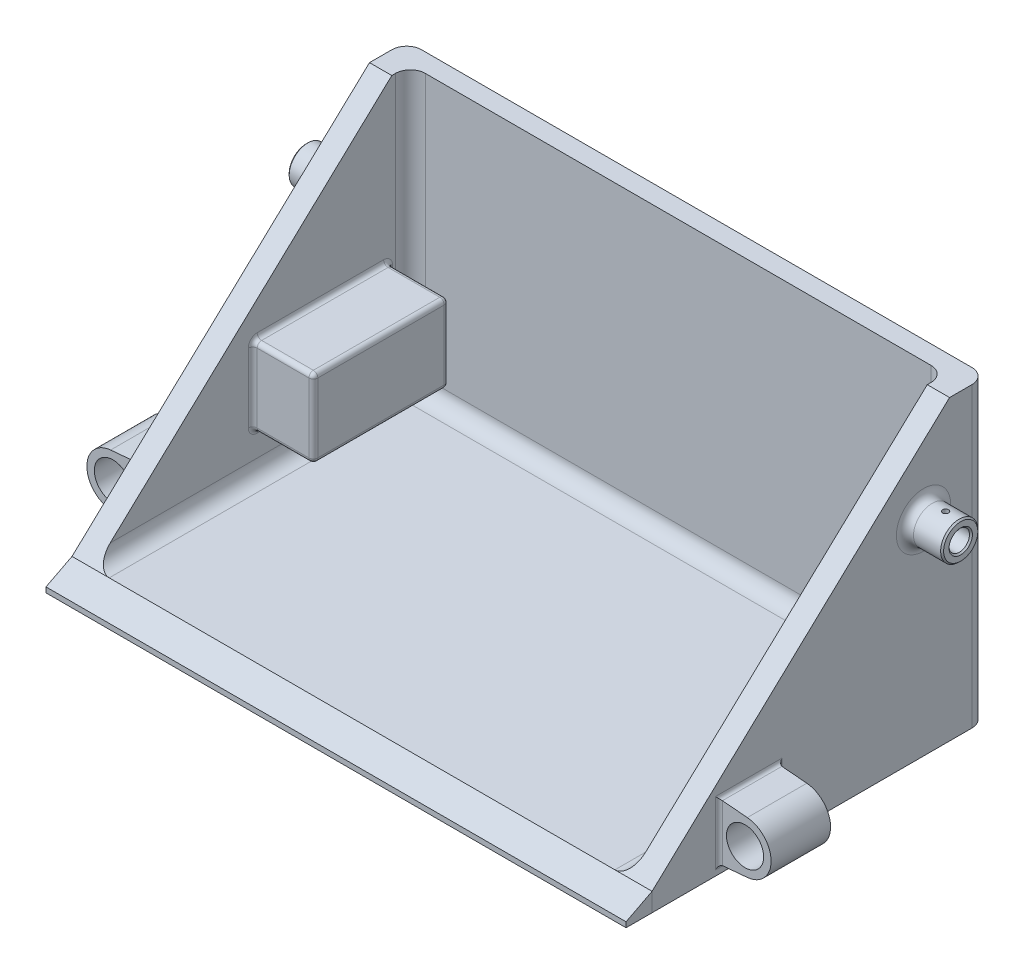
from build123d import *

# Parameters (mm, degrees)
SKETCH1_W               = 198.12
SKETCH1_H               = 114.3
BOSS_EXTRUDE1_DEPTH     = 3.175
BOSS_EXTRUDE2_DEPTH     = 7.62
SKETCH4_W               = 182.88
SKETCH4_H               = 6.35
BOSS_EXTRUDE3_DEPTH     = 95.25
BOSS_EXTRUDE4_DEPTH     = 198.12
FILLET2_R               = 5.08
FILLET3_R               = 5.08
SKETCH6_R               = 6.35
SKETCH6_R_2             = 3.4925
BOSS_EXTRUDE5_DEPTH     = 12.7
FILLET4_R               = 2.921
CHAMFER1_SIZE           = 0.508
SKETCH7_R               = 1.0033
CUT_EXTRUDE1_DEPTH      = 3.81
CIRPATTERN1_COUNT       = 2
CIRPATTERN1_ANGLE       = 90
MIRROR3_COPY_1_SKETCH_R = 1.0033
MIRROR3_COPY_1_DEPTH    = 3.81
SKETCH8_W               = 41.148
SKETCH8_H               = 21.59
CUT_EXTRUDE2_DEPTH      = 7.62
SKETCH9_W               = 46.228
SKETCH9_H               = 26.67
SKETCH9_W_2             = 41.148
SKETCH9_H_2             = 21.59
BOSS_EXTRUDE6_DEPTH     = 17.78
SKETCH10_W              = 46.228
SKETCH10_H              = 26.67
BOSS_EXTRUDE7_DEPTH     = 2.921
FILLET5_R               = 1.524
FILLET6_R               = 1.524
SKETCH11_W              = 7.62
SKETCH11_H              = 16.51
SKETCH11_R              = 1.524
BOSS_EXTRUDE8_DEPTH     = 3.81
FILLET7_R               = 1.27
SKETCH12_R              = 6.35
BOSS_EXTRUDE9_DEPTH     = 10.16
FILLET8_R               = 1.27


with BuildPart() as part:
    # Sketch1 → Boss-Extrude1 (new, symmetric)
    with BuildSketch(Plane(origin=(0, 0, 0), x_dir=(1, 0, 0), z_dir=(0, 1, 0))):
        Rectangle(SKETCH1_W, SKETCH1_H)
    extrude(amount=BOSS_EXTRUDE1_DEPTH, both=True)

    # Sketch3 → Boss-Extrude2 (add)
    with BuildSketch(Plane.ZY.offset(99.06)):
        Polygon((-57.15, 3.175), (-57.15, 98.425), (-44.45, 98.425), (57.15, 3.175), align=None)
    boss_extrude2 = extrude(amount=-BOSS_EXTRUDE2_DEPTH)

    # Mirror1: Boss-Extrude2 across plane
    add(boss_extrude2.mirror(Plane(origin=(0, 0, 0), x_dir=(0, 0, 1), z_dir=(1, 0, 0))))

    # Sketch4 → Boss-Extrude3 (add)
    with BuildSketch(Plane(origin=(0, 3.175, 0), x_dir=(1, 0, 0), z_dir=(0, 1, 0))):
        with Locations((0, 53.975)):
            Rectangle(SKETCH4_W, SKETCH4_H)
    extrude(amount=BOSS_EXTRUDE3_DEPTH)

    # Fillet2
    fillet2_edges = [part.edges().sort_by_distance(p)[0] for p in [
        (91.44, 3.175, 3.175),
        (-91.44, 3.175, 3.175),
        (-91.44, 50.8, -50.8),
        (0, 3.175, -50.8),
        (91.44, 50.8, -50.8),
    ]]
    fillet(fillet2_edges, radius=FILLET2_R)

    # Fillet3
    fillet3_edges = [part.edges().sort_by_distance(p)[0] for p in [
        (-99.06, 47.625, -57.15),
        (99.06, 47.625, -57.15),
    ]]
    fillet(fillet3_edges, radius=FILLET3_R)

    # Sketch6 → Boss-Extrude5 (add)
    with BuildSketch(Plane(origin=(99.06, 0, 0), x_dir=(0, 0, -1), z_dir=(1, 0, 0))):
        with Locations(Location((35.56, 66.675, 0), (0, 0, 180))):
            Circle(SKETCH6_R)
        with Locations((35.56, 66.675)):
            Circle(SKETCH6_R_2, mode=Mode.SUBTRACT)
    boss_extrude5 = extrude(amount=BOSS_EXTRUDE5_DEPTH)

    # Mirror2: Boss-Extrude5 across plane
    add(boss_extrude5.mirror(Plane(origin=(0, 0, 0), x_dir=(0, 0, 1), z_dir=(1, 0, 0))))

    # Fillet4
    fillet4_edges = [part.edges().sort_by_distance(p)[0] for p in [
        (-99.06, 66.675, -41.91),
        (99.06, 66.675, -41.91),
    ]]
    fillet(fillet4_edges, radius=FILLET4_R)

    # Chamfer1
    chamfer1_edges = [part.edges().sort_by_distance(p)[0] for p in [
        (-111.76, 66.675, -41.91),
        (-111.76, 66.675, -32.0675),
        (111.76, 66.675, -41.91),
        (111.76, 66.675, -32.0675),
    ]]
    chamfer(chamfer1_edges, length=CHAMFER1_SIZE)

    # Sketch7 → Cut-Extrude1 (cut)
    with BuildSketch(Plane(origin=(0, 73.025, 0), x_dir=(1, 0, 0), z_dir=(0, 1, 0))):
        with Locations(Location((106.6165, 35.56, 0), (0, 0, 270))):
            Circle(SKETCH7_R)
    cut_extrude1 = extrude(amount=-CUT_EXTRUDE1_DEPTH, mode=Mode.SUBTRACT)

    # CirPattern1: Cut-Extrude1 ×2 about axis
    cirpattern1_axis = Axis((111.76, 66.675, -35.56), (-1, 0, 0))
    for i in range(1, CIRPATTERN1_COUNT):
        add(cut_extrude1.rotate(cirpattern1_axis, i * CIRPATTERN1_ANGLE / (CIRPATTERN1_COUNT - 1)), mode=Mode.SUBTRACT)

    # Mirror3: Cut-Extrude1 across plane
    add(cut_extrude1.mirror(Plane(origin=(0, 0, 0), x_dir=(0, 0, 1), z_dir=(1, 0, 0))), mode=Mode.SUBTRACT)

    # Mirror3 copy 1 sketch → Mirror3 copy 1 (cut)
    with BuildSketch(Plane(origin=(0, 102.235, -41.91), x_dir=(-1, 0, 0), z_dir=(0, 0, -1))):
        with Locations((106.6165, -35.56)):
            Circle(MIRROR3_COPY_1_SKETCH_R)
    extrude(amount=-MIRROR3_COPY_1_DEPTH, mode=Mode.SUBTRACT)

    # Sketch8 → Cut-Extrude2 (cut)
    with BuildSketch(Plane.ZY.offset(99.06)):
        with Locations((-20.066, 30.48)):
            Rectangle(SKETCH8_W, SKETCH8_H)
    extrude(amount=-CUT_EXTRUDE2_DEPTH, mode=Mode.SUBTRACT)

    # Sketch9 → Boss-Extrude6 (add)
    with BuildSketch(Plane(origin=(-91.44, 0, 0), x_dir=(0, 0, -1), z_dir=(1, 0, 0))):
        with Locations((20.066, 30.48)):
            Rectangle(SKETCH9_W, SKETCH9_H)
        with Locations((20.066, 30.48)):
            Rectangle(SKETCH9_W_2, SKETCH9_H_2, mode=Mode.SUBTRACT)
    extrude(amount=BOSS_EXTRUDE6_DEPTH)

    # Sketch10 → Boss-Extrude7 (add)
    with BuildSketch(Plane(origin=(-73.66, 0, 0), x_dir=(0, 0, -1), z_dir=(1, 0, 0))):
        with Locations((20.066, 30.48)):
            Rectangle(SKETCH10_W, SKETCH10_H)
    extrude(amount=BOSS_EXTRUDE7_DEPTH)

    # Fillet5
    fillet5_edges = [part.edges().sort_by_distance(p)[0] for p in [
        (-91.44, 30.48, -43.18),
        (-81.0895, 17.145, -43.18),
        (-91.44, 43.815, -20.066),
        (-81.0895, 43.815, -43.18),
        (-91.44, 30.48, 3.048),
        (-81.0895, 43.815, 3.048),
        (-91.44, 17.145, -20.066),
        (-81.0895, 17.145, 3.048),
        (-70.739, 17.145, -20.066),
        (-70.739, 30.48, -43.18),
        (-70.739, 43.815, -20.066),
        (-70.739, 30.48, 3.048),
    ]]
    fillet(fillet5_edges, radius=FILLET5_R)

    # Fillet6
    fillet6_edges = [part.edges().sort_by_distance(p)[0] for p in [
        (-86.36, 41.275, -40.64),
        (-86.36, 19.685, -40.64),
        (-86.36, 19.685, 0.508),
        (-86.36, 41.275, 0.508),
    ]]
    fillet(fillet6_edges, radius=FILLET6_R)

    # Sketch11 → Boss-Extrude8 (add)
    # profile 1 of 2: a face of its own
    with BuildSketch(Plane.ZY.offset(99.06)):
        with Locations((-44.45, 30.48)):
            Rectangle(SKETCH11_W, SKETCH11_H)
        with Locations(Location((-45.085, 35.56, 0), (0, 0, 180))):
            Circle(SKETCH11_R, mode=Mode.SUBTRACT)
        with Locations(Location((-45.085, 25.4, 0), (0, 0, 180))):
            Circle(SKETCH11_R, mode=Mode.SUBTRACT)
    # profile 2 of 2: a face of its own
    with BuildSketch(Plane.ZY.offset(99.06)):
        with Locations((4.318, 30.48)):
            Rectangle(SKETCH11_W, SKETCH11_H)
        with Locations(Location((4.953, 35.56, 0), (0, 0, 180))):
            Circle(SKETCH11_R, mode=Mode.SUBTRACT)
        with Locations(Location((4.953, 25.4, 0), (0, 0, 180))):
            Circle(SKETCH11_R, mode=Mode.SUBTRACT)
    extrude(amount=BOSS_EXTRUDE8_DEPTH)

    # Fillet7
    fillet7_edges = [part.edges().sort_by_distance(p)[0] for p in [
        (-99.06, 38.735, -44.45),
        (-99.06, 30.48, -48.26),
        (-99.06, 22.225, -44.45),
        (-99.06, 22.225, 4.318),
        (-99.06, 30.48, 8.128),
        (-99.06, 38.735, 4.318),
    ]]
    fillet(fillet7_edges, radius=FILLET7_R)

    # Sketch12 → Boss-Extrude9 (add, symmetric)
    with BuildSketch(Plane(origin=(0, 0, 24.13), x_dir=(-1, 0, 0), z_dir=(0, 0, -1))):
        with BuildLine():
            Line((108.724814553, 18.381170866), (99.06, 19.226732575))
            Line((99.06, 19.226732575), (99.06, -0.176732575))
            Line((99.06, -0.176732575), (108.724814553, 0.668829134))
            ThreePointArc((108.724814553, 0.668829134), (116.84, 9.525), (108.724814553, 18.381170866))
        make_face()
        with Locations((107.95, 9.525)):
            Circle(SKETCH12_R, mode=Mode.SUBTRACT)
    boss_extrude9 = extrude(amount=BOSS_EXTRUDE9_DEPTH, both=True)

    # Mirror4: Boss-Extrude9 across plane
    add(boss_extrude9.mirror(Plane(origin=(0, 0, 0), x_dir=(0, 0, 1), z_dir=(1, 0, 0))))

    # Fillet8
    fillet8_edges = [part.edges().sort_by_distance(p)[0] for p in [
        (-99.06, 9.525, 13.97),
        (-99.06, 9.525, 34.29),
        (-99.06, 19.226732575, 24.13),
        (-99.06, -0.176732575, 24.13),
        (99.06, 9.525, 13.97),
        (99.06, -0.176732575, 24.13),
        (99.06, 19.226732575, 24.13),
        (99.06, 9.525, 34.29),
    ]]
    fillet(fillet8_edges, radius=FILLET8_R)


with BuildPart() as body_2:
    # Sketch5 → Boss-Extrude4 (new body)
    with BuildSketch(Plane.ZY.offset(99.06)):
        Polygon((66.04, -3.175), (57.15, -3.175), (57.15, 3.175), (66.04, -1.397), align=None)
    extrude(amount=-BOSS_EXTRUDE4_DEPTH)


solid = Compound([part.part, body_2.part])
